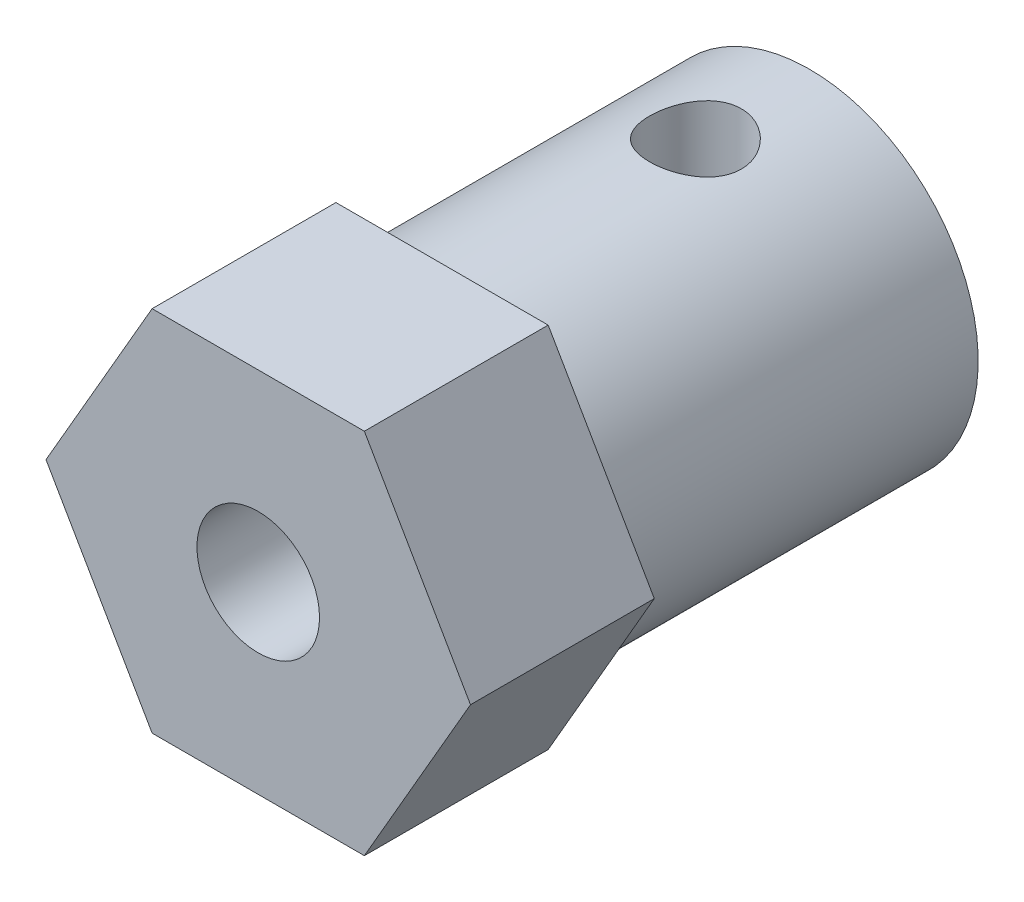
from build123d import *

# Parameters (mm, degrees)
SKETCH_1_R          = 2
EXTRUDE_1_DEPTH     = 6
SKETCH_2_R          = 5.5
SKETCH_2_R_2        = 3
EXTRUDE_2_DEPTH     = 12
CUT_EXTRUDE_START   = 10
SKETCH_3_R          = 1.5
CUT_EXTRUDE_1_DEPTH = 20


with BuildPart() as part:
    # 草图1 → 凸台-拉伸1 (new body)
    with BuildSketch(Plane.XY):
        Polygon((-3.464101615, 6), (3.464101615, 6), (6.92820323, 0), (3.464101615, -6), (-3.464101615, -6), (-6.92820323, 0), align=None)
        Circle(SKETCH_1_R, mode=Mode.SUBTRACT)
    extrude(amount=EXTRUDE_1_DEPTH)

    # 草图2 → 凸台-拉伸2 (add)
    with BuildSketch(Plane(origin=(0, 0, 0), x_dir=(-1, 0, 0), z_dir=(0, 0, -1))):
        Circle(SKETCH_2_R)
        Circle(SKETCH_2_R_2, mode=Mode.SUBTRACT)
    extrude(amount=EXTRUDE_2_DEPTH)

    # 草图3 → 切除-拉伸1 (cut)
    with BuildSketch(Plane(origin=(0, 0, 0), x_dir=(1, 0, 0), z_dir=(0, 1, 0)).offset(CUT_EXTRUDE_START)):
        with Locations(Location((0, 8.269925745, 0), (0, 0, 270))):
            Circle(SKETCH_3_R)
    extrude(amount=-CUT_EXTRUDE_1_DEPTH, mode=Mode.SUBTRACT)


solid = part.part
